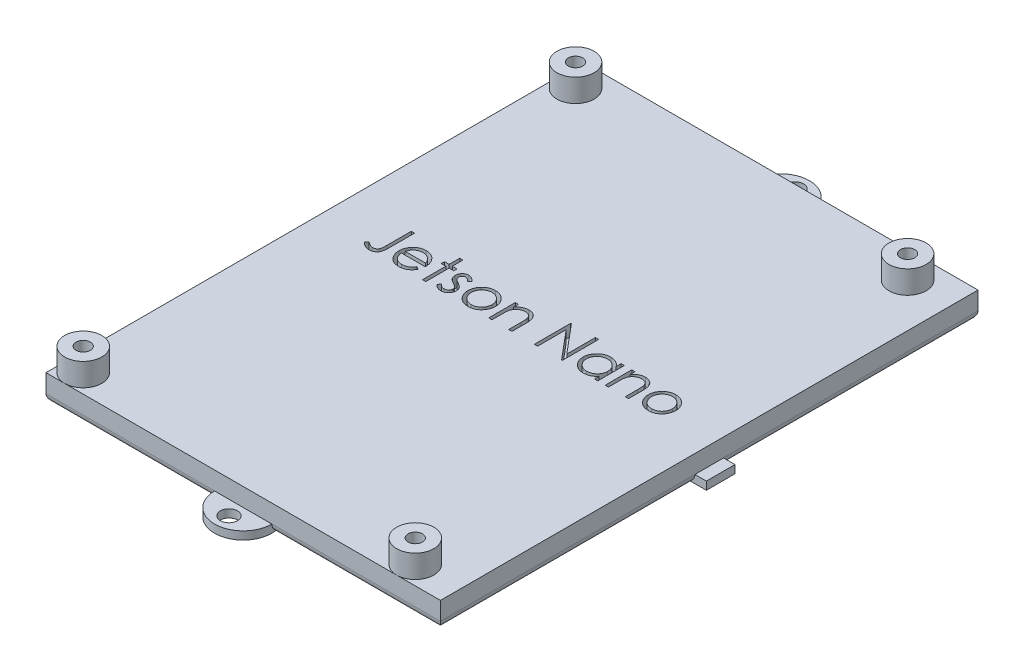
from build123d import *

# Parameters (mm, degrees)
SKETCH1_W           = 68.9
SKETCH1_H           = 93.9
BOSS_EXTRUDE1_DEPTH = 4.575
SKETCH8_R           = 3.25
SKETCH8_R_2         = 1.25
BOSS_EXTRUDE5_DEPTH = 4
CUT_EXTRUDE1_START  = -3.575
SKETCH3_R           = 1.25
CUT_EXTRUDE1_DEPTH  = 3.575
SKETCH4_R           = 1.5
BOSS_EXTRUDE3_DEPTH = 1.4
CUT_EXTRUDE2_DEPTH  = 2
SKETCH6_W           = 5
SKETCH6_H           = 1.4
BOSS_EXTRUDE4_DEPTH = 2
FILLET1_R           = 1.4


with BuildPart() as part:
    # Sketch1 → Boss-Extrude1 (new body)
    with BuildSketch(Plane(origin=(0, 0, 0), x_dir=(1, 0, 0), z_dir=(0, 1, 0))):
        Rectangle(SKETCH1_W, SKETCH1_H)
    extrude(amount=BOSS_EXTRUDE1_DEPTH)

    # Sketch8 → Boss-Extrude5 (add)
    # profile 1 of 4: a face of its own
    with BuildSketch(Plane(origin=(0, 4.575, 0), x_dir=(1, 0, 0), z_dir=(0, 1, 0))):
        with Locations(Location((-31.2, 42.3, 0), (0, 0, 180))):
            Circle(SKETCH8_R)
        with Locations(Location((-31.2, 42.3, 0), (0, 0, 270))):
            Circle(SKETCH8_R_2, mode=Mode.SUBTRACT)
    # profile 2 of 4: a face of its own
    with BuildSketch(Plane(origin=(0, 4.575, 0), x_dir=(1, 0, 0), z_dir=(0, 1, 0))):
        with Locations(Location((26.8, 42.3, 0), (0, 0, 270))):
            Circle(SKETCH8_R)
        with Locations(Location((26.8, 42.3, 0), (0, 0, 270))):
            Circle(SKETCH8_R_2, mode=Mode.SUBTRACT)
    # profile 3 of 4: a face of its own
    with BuildSketch(Plane(origin=(0, 4.575, 0), x_dir=(1, 0, 0), z_dir=(0, 1, 0))):
        with Locations(Location((26.8, -43.7, 0), (0, 0, 270))):
            Circle(SKETCH8_R)
        with Locations(Location((26.8, -43.7, 0), (0, 0, 270))):
            Circle(SKETCH8_R_2, mode=Mode.SUBTRACT)
    # profile 4 of 4: a face of its own
    with BuildSketch(Plane(origin=(0, 4.575, 0), x_dir=(1, 0, 0), z_dir=(0, 1, 0))):
        with Locations(Location((-31.2, -43.7, 0), (0, 0, 270))):
            Circle(SKETCH8_R)
        with Locations(Location((-31.2, -43.7, 0), (0, 0, 270))):
            Circle(SKETCH8_R_2, mode=Mode.SUBTRACT)
    extrude(amount=BOSS_EXTRUDE5_DEPTH)

    # Sketch3 → Cut-Extrude1 (cut)
    with BuildSketch(Plane(origin=(0, 4.575, 0), x_dir=(1, 0, 0), z_dir=(0, 1, 0)).offset(CUT_EXTRUDE1_START)):
        with Locations(Location((-31.2, 42.3, 0), (0, 0, 270))):
            Circle(SKETCH3_R)
        with Locations(Location((26.8, 42.3, 0), (0, 0, 270))):
            Circle(SKETCH3_R)
        with Locations(Location((26.8, -43.7, 0), (0, 0, 270))):
            Circle(SKETCH3_R)
        with Locations(Location((-31.2, -43.7, 0), (0, 0, 270))):
            Circle(SKETCH3_R)
    extrude(amount=CUT_EXTRUDE1_DEPTH, mode=Mode.SUBTRACT)

    # Sketch4 → Boss-Extrude3 (add)
    with BuildSketch(Plane(origin=(0, 0, 0), x_dir=(1, 0, 0), z_dir=(0, 1, 0))):
        with BuildLine():
            Line((-5, -46.95), (5, -46.95))
            ThreePointArc((5, -46.95), (0, -51.95), (-5, -46.95))
        make_face()
        with Locations(Location((0, -49.45, 0), (0, 0, 270))):
            Circle(SKETCH4_R, mode=Mode.SUBTRACT)
    boss_extrude3 = extrude(amount=BOSS_EXTRUDE3_DEPTH)

    # Mirror1: Boss-Extrude3 across plane
    add(boss_extrude3.mirror(Plane.XY))

    # Sketch5 → Cut-Extrude2 (cut)
    # profile 1 of 10: a face of its own
    with BuildSketch(Plane(origin=(0, 4.575, 0), x_dir=(1, 0, 0), z_dir=(0, 1, 0))):
        with BuildLine():
            Line((-23.934615385, 6.35), (-23.36474359, 6.35))
            Line((-23.36474359, 6.35), (-23.36474359, 2.061969151))
            add(Edge.make_bspline(
                [(-23.36474359, 2.061969151), (-23.365313128, 1.982675483), (-23.36640671, 1.830421967), (-23.372419998, 1.611122184), (-23.383547879, 1.410878225), (-23.399758545, 1.229234757), (-23.421385253, 1.066760835), (-23.446133976, 0.922201057), (-23.47609291, 0.796761919), (-23.521207785, 0.655909202), (-23.595183377, 0.501434014), (-23.706520718, 0.334601098), (-23.844828792, 0.18867191), (-24.005032095, 0.061939109), (-24.18853081, -0.039039011), (-24.39154615, -0.11152912), (-24.612828387, -0.155744817), (-24.76631553, -0.160414616), (-24.845392628, -0.162820513)],
                knots=[0, 0, 0, 0, 1.237770943, 2.376671248, 3.424123796, 4.367912054, 5.222547132, 5.982086412, 6.656319012, 7.234008312, 8.288027371, 9.317870876, 10.352700517, 11.413286737, 12.494591526, 13.606319346, 14.766767577, 16, 16, 16, 16], degree=3))
            add(Edge.make_bspline(
                [(-24.845392628, -0.162820513), (-24.907002792, -0.160859979), (-25.030966524, -0.156915255), (-25.215462524, -0.124763005), (-25.39943468, -0.075203897), (-25.583859451, -0.00262776), (-25.772380504, 0.09607954), (-25.967551104, 0.225229136), (-26.171881751, 0.384580619), (-26.306471427, 0.506206244), (-26.376923077, 0.569871795)],
                knots=[0, 0, 0, 0, 0.848567217, 1.707373443, 2.573483905, 3.470863513, 4.432650262, 5.500696352, 6.691726801, 8, 8, 8, 8], degree=3))
            Line((-26.376923077, 0.569871795), (-26.041105769, 1.058333333))
            add(Edge.make_bspline(
                [(-26.041105769, 1.058333333), (-25.963630909, 1.004907343), (-25.81734827, 0.904032107), (-25.602347356, 0.774262418), (-25.411852521, 0.663001046), (-25.287242031, 0.606300483), (-25.229547276, 0.580048077)],
                knots=[0, 0, 0, 0, 1.196737151, 2.259595785, 3.194191475, 4, 4, 4, 4], degree=3))
            add(Edge.make_bspline(
                [(-25.229547276, 0.580048077), (-25.194560025, 0.566333061), (-25.125942234, 0.539434862), (-25.021031019, 0.509415875), (-24.916718594, 0.49301036), (-24.847562207, 0.489959941), (-24.813591747, 0.488461538)],
                knots=[0, 0, 0, 0, 1.051806502, 2.062826769, 3.048436908, 4, 4, 4, 4], degree=3))
            add(Edge.make_bspline(
                [(-24.813591747, 0.488461538), (-24.769717259, 0.490317072), (-24.682993574, 0.493984777), (-24.556966042, 0.526368462), (-24.436392186, 0.575797593), (-24.325594378, 0.648171798), (-24.223476604, 0.734225947), (-24.139216049, 0.838286134), (-24.068971906, 0.953612991), (-24.026699605, 1.0627812), (-23.999766947, 1.162343086), (-23.982673424, 1.253843204), (-23.96772614, 1.360816172), (-23.954696753, 1.483389679), (-23.947068643, 1.621809123), (-23.938510162, 1.775668068), (-23.935416331, 1.945354423), (-23.934890514, 2.063665722), (-23.934615385, 2.125570913)],
                knots=[0, 0, 0, 0, 0.997221856, 1.971139923, 2.944579524, 3.951425367, 4.971190333, 5.972282193, 6.985401279, 8.033996657, 8.624075553, 9.332086008, 10.151144245, 11.082816738, 12.137127781, 13.306538797, 14.590673636, 16, 16, 16, 16], degree=3))
            Line((-23.934615385, 2.125570913), (-23.934615385, 6.35))
        make_face()
    # profile 2 of 10: a face of its own
    with BuildSketch(Plane(origin=(0, 4.575, 0), x_dir=(1, 0, 0), z_dir=(0, 1, 0))):
        with BuildLine():
            Line((-18.090885417, 1.465384615), (-17.584615385, 1.199529247))
            add(Edge.make_bspline(
                [(-17.584615385, 1.199529247), (-17.624958922, 1.127967774), (-17.703451469, 0.988737488), (-17.838435683, 0.79745397), (-17.979935586, 0.625373114), (-18.134338499, 0.477092169), (-18.297024917, 0.3478218), (-18.468897019, 0.234723175), (-18.650849588, 0.138351002), (-18.842891232, 0.05715713), (-19.046634703, -0.005271524), (-19.26257374, -0.049366324), (-19.491122024, -0.076622826), (-19.647778665, -0.07978901), (-19.727994792, -0.081410256)],
                knots=[0, 0, 0, 0, 1.120438281, 2.179929193, 3.190490725, 4.156257408, 5.095198341, 6.022838206, 6.959905092, 7.901321166, 8.864066838, 9.862729781, 10.905609505, 12, 12, 12, 12], degree=3))
            add(Edge.make_bspline(
                [(-19.727994792, -0.081410256), (-19.817152379, -0.079328953), (-19.991073004, -0.075268932), (-20.244237974, -0.040266889), (-20.482597776, 0.016832962), (-20.706139009, 0.096599015), (-20.914314239, 0.200788589), (-21.107537218, 0.327715078), (-21.286824072, 0.476726454), (-21.446525138, 0.64911343), (-21.590296182, 0.833593552), (-21.717161598, 1.0258278), (-21.82322008, 1.225332507), (-21.909494102, 1.430837601), (-21.979171499, 1.641047808), (-22.027733948, 1.857875756), (-22.055727919, 2.080734602), (-22.060017699, 2.231496911), (-22.062179487, 2.307471955)],
                knots=[0, 0, 0, 0, 1.145258523, 2.234067595, 3.276747158, 4.290159414, 5.277019952, 6.260822364, 7.254936242, 8.264827045, 9.274100331, 10.257902744, 11.220704747, 12.172965371, 13.118907548, 14.062713208, 15.023725156, 16, 16, 16, 16], degree=3))
            add(Edge.make_bspline(
                [(-22.062179487, 2.307471955), (-22.060257902, 2.378764005), (-22.056449575, 2.520055432), (-22.032445146, 2.729180063), (-21.989903243, 2.932431684), (-21.931526198, 3.129979182), (-21.856140366, 3.321491797), (-21.763916196, 3.507086084), (-21.654710025, 3.686564552), (-21.570395317, 3.799781666), (-21.527924679, 3.856810897)],
                knots=[0, 0, 0, 0, 1.024358464, 2.0301432, 3.019427413, 4.004406732, 4.986367066, 5.972626655, 6.978780325, 8, 8, 8, 8], degree=3))
            add(Edge.make_bspline(
                [(-21.527924679, 3.856810897), (-21.470397884, 3.925515847), (-21.357166595, 4.060749349), (-21.165657207, 4.238437454), (-20.958283994, 4.387288304), (-20.737645758, 4.510672679), (-20.501178155, 4.604423439), (-20.25205987, 4.674287195), (-19.987454306, 4.713435872), (-19.806560548, 4.718965513), (-19.714002404, 4.721794872)],
                knots=[0, 0, 0, 0, 1.030682036, 2.02871468, 2.997146059, 3.962720338, 4.930598197, 5.918074684, 6.934738563, 8, 8, 8, 8], degree=3))
            add(Edge.make_bspline(
                [(-19.714002404, 4.721794872), (-19.618847463, 4.71933824), (-19.432175159, 4.714518889), (-19.159974026, 4.669839684), (-18.902416726, 4.598987192), (-18.659606325, 4.498922458), (-18.431518206, 4.3698187), (-18.219634945, 4.209904216), (-18.020332915, 4.024088544), (-17.904384493, 3.881189578), (-17.845382612, 3.808473558)],
                knots=[0, 0, 0, 0, 1.056321875, 2.072262726, 3.055038591, 4.01806755, 4.982017516, 5.957941055, 6.960871419, 8, 8, 8, 8], degree=3))
            add(Edge.make_bspline(
                [(-17.845382612, 3.808473558), (-17.805238024, 3.753675631), (-17.725216062, 3.64444453), (-17.624982038, 3.466334003), (-17.537973621, 3.279987638), (-17.468426678, 3.082393242), (-17.412112154, 2.875892004), (-17.371369069, 2.659007673), (-17.347475618, 2.431804834), (-17.342778981, 2.276998083), (-17.340384615, 2.198076923)],
                knots=[0, 0, 0, 0, 0.94817472, 1.890038105, 2.849395472, 3.817997239, 4.812318967, 5.836947057, 6.897266129, 8, 8, 8, 8], degree=3))
            Line((-17.340384615, 2.198076923), (-21.492307692, 2.198076923))
            add(Edge.make_bspline(
                [(-21.492307692, 2.198076923), (-21.489514406, 2.136934652), (-21.484021522, 2.016700843), (-21.45841262, 1.840768136), (-21.418046987, 1.673176501), (-21.361315974, 1.515182982), (-21.292614697, 1.364724036), (-21.208457754, 1.222915769), (-21.108055992, 1.090404096), (-20.996067937, 0.966003718), (-20.871413636, 0.855222051), (-20.74027208, 0.756068114), (-20.600765183, 0.672963675), (-20.453992946, 0.605508732), (-20.300192707, 0.552701558), (-20.139316011, 0.516655655), (-19.971679428, 0.492512761), (-19.857405311, 0.489828226), (-19.799228766, 0.488461538)],
                knots=[0, 0, 0, 0, 1.094153842, 2.151609401, 3.174256925, 4.172055639, 5.149267565, 6.128595816, 7.11444997, 8.118368179, 9.117203808, 10.09244225, 11.054858984, 12.015122123, 12.976791628, 13.957293641, 14.960065497, 16, 16, 16, 16], degree=3))
            add(Edge.make_bspline(
                [(-19.799228766, 0.488461538), (-19.742348827, 0.489564727), (-19.629488116, 0.491753665), (-19.461411132, 0.513038703), (-19.29605799, 0.547456203), (-19.134113063, 0.594428042), (-18.978863099, 0.651717474), (-18.83508903, 0.720846944), (-18.702863496, 0.797318628), (-18.579279857, 0.884784752), (-18.459408197, 0.991842463), (-18.3404954, 1.1254387), (-18.212993472, 1.283440357), (-18.133183782, 1.402358923), (-18.090885417, 1.465384615)],
                knots=[0, 0, 0, 0, 0.99110716, 1.966546729, 2.947904876, 3.932708344, 4.903319531, 5.828989031, 6.710028674, 7.56322171, 8.463672341, 9.504779593, 10.677557249, 12, 12, 12, 12], degree=3))
        make_face()
        with BuildLine():
            add(Edge.make_bspline(
                [(-17.91025641, 2.767948718), (-17.931114572, 2.843537075), (-17.971259819, 2.989020329), (-18.055145794, 3.19048023), (-18.149618447, 3.369528279), (-18.261417874, 3.524794185), (-18.38808899, 3.662686273), (-18.534402393, 3.783188563), (-18.698478943, 3.890988796), (-18.879470526, 3.981979759), (-19.071134908, 4.05943136), (-19.271806142, 4.111365498), (-19.476562414, 4.146942811), (-19.615054619, 4.150255893), (-19.684745593, 4.151923077)],
                knots=[0, 0, 0, 0, 1.154881502, 2.222775134, 3.210006277, 4.132804581, 5.035138423, 5.962687519, 6.919655026, 7.923214229, 8.944639381, 9.960483929, 10.97369054, 12, 12, 12, 12], degree=3))
            add(Edge.make_bspline(
                [(-19.684745593, 4.151923077), (-19.741622431, 4.15081333), (-19.854055983, 4.148619594), (-20.019702207, 4.127809502), (-20.178778232, 4.093410926), (-20.332457825, 4.046303076), (-20.478727115, 3.983513183), (-20.620594766, 3.909883615), (-20.754453485, 3.820001027), (-20.838166978, 3.751495676), (-20.880458734, 3.716887019)],
                knots=[0, 0, 0, 0, 1.04873581, 2.073130211, 3.073294108, 4.04793562, 5.032784715, 6.005352987, 6.992311501, 8, 8, 8, 8], degree=3))
            add(Edge.make_bspline(
                [(-20.880458734, 3.716887019), (-20.910745117, 3.689501618), (-20.972037375, 3.63408024), (-21.053935178, 3.538595823), (-21.132349464, 3.435632274), (-21.203711948, 3.321250405), (-21.269166998, 3.196752706), (-21.330417243, 3.063189282), (-21.385546876, 2.919546603), (-21.416564104, 2.819448035), (-21.432522035, 2.767948718)],
                knots=[0, 0, 0, 0, 0.879870761, 1.780643979, 2.707998968, 3.669668524, 4.684282772, 5.740141944, 6.837334558, 8, 8, 8, 8], degree=3))
            Line((-21.432522035, 2.767948718), (-17.91025641, 2.767948718))
        make_face(mode=Mode.SUBTRACT)
    # profile 3 of 10: a face of its own
    with BuildSketch(Plane(origin=(0, 4.575, 0), x_dir=(1, 0, 0), z_dir=(0, 1, 0))):
        Polygon((-15.630769231, 6.512820513), (-15.060897436, 6.512820513), (-15.060897436, 4.640384615), (-14.246794872, 4.640384615), (-14.246794872, 4.070512821), (-15.060897436, 4.070512821), (-15.060897436, 0), (-15.630769231, 0), (-15.630769231, 4.070512821), (-16.444871795, 4.070512821), (-16.444871795, 4.640384615), (-15.630769231, 4.640384615), align=None)
    # profile 4 of 10: a face of its own
    with BuildSketch(Plane(origin=(0, 4.575, 0), x_dir=(1, 0, 0), z_dir=(0, 1, 0))):
        with BuildLine():
            Line((-11.071794872, 4.061608574), (-11.45849359, 3.663461538))
            add(Edge.make_bspline(
                [(-11.45849359, 3.663461538), (-11.491859218, 3.702129675), (-11.55618422, 3.776677291), (-11.658204193, 3.876348826), (-11.759847016, 3.960054415), (-11.859721292, 4.030724942), (-11.960338438, 4.084154108), (-12.060517704, 4.123151929), (-12.160362815, 4.147285205), (-12.227103193, 4.150395687), (-12.259875801, 4.151923077)],
                knots=[0, 0, 0, 0, 1.26578478, 2.440284043, 3.530471711, 4.527705817, 5.468200915, 6.346673037, 7.188140097, 8, 8, 8, 8], degree=3))
            add(Edge.make_bspline(
                [(-12.259875801, 4.151923077), (-12.30004298, 4.14997295), (-12.379086303, 4.146135377), (-12.492344573, 4.107829582), (-12.597483565, 4.049030871), (-12.688482657, 3.965630726), (-12.765567448, 3.869901267), (-12.821835126, 3.762865078), (-12.856244839, 3.647752198), (-12.86060771, 3.567869457), (-12.862820513, 3.527353766)],
                knots=[0, 0, 0, 0, 0.99966794, 1.967205029, 2.953328237, 3.988086729, 5.028030931, 6.008226631, 6.989793394, 8, 8, 8, 8], degree=3))
            add(Edge.make_bspline(
                [(-12.862820513, 3.527353766), (-12.860805182, 3.490683343), (-12.856780202, 3.417445871), (-12.825489798, 3.309408723), (-12.775658495, 3.204076668), (-12.729085429, 3.139555396), (-12.705088141, 3.106310096)],
                knots=[0, 0, 0, 0, 0.960159726, 1.917612774, 2.927026955, 4, 4, 4, 4], degree=3))
            add(Edge.make_bspline(
                [(-12.705088141, 3.106310096), (-12.690640088, 3.088558065), (-12.659889228, 3.050775103), (-12.602179494, 2.998335254), (-12.536824382, 2.940382885), (-12.458229637, 2.882440338), (-12.369781344, 2.821422779), (-12.2695615, 2.759733195), (-12.160750612, 2.692669167), (-12.08285007, 2.650134262), (-12.042357772, 2.62802484)],
                knots=[0, 0, 0, 0, 0.66740084, 1.420478572, 2.27185888, 3.217733974, 4.268547843, 5.408967954, 6.65319498, 8, 8, 8, 8], degree=3))
            add(Edge.make_bspline(
                [(-12.042357772, 2.62802484), (-11.992984568, 2.60036623), (-11.897611795, 2.546938904), (-11.762097775, 2.464008442), (-11.639112715, 2.381582858), (-11.527614575, 2.300543661), (-11.429748722, 2.218623459), (-11.342545891, 2.138962243), (-11.268181142, 2.059153069), (-11.226536161, 2.00339442), (-11.206630609, 1.976742788)],
                knots=[0, 0, 0, 0, 1.27191281, 2.456916733, 3.569705269, 4.599008579, 5.553216877, 6.436649441, 7.252746552, 8, 8, 8, 8], degree=3))
            add(Edge.make_bspline(
                [(-11.206630609, 1.976742788), (-11.173591509, 1.922920029), (-11.107837569, 1.815802748), (-11.038789, 1.639420743), (-10.998765358, 1.452348832), (-10.993209616, 1.324383233), (-10.990384615, 1.259314904)],
                knots=[0, 0, 0, 0, 0.995354457, 1.980940102, 2.973342416, 4, 4, 4, 4], degree=3))
            add(Edge.make_bspline(
                [(-10.990384615, 1.259314904), (-10.991690055, 1.213469453), (-10.994262567, 1.123125983), (-11.012147917, 0.990075649), (-11.042909089, 0.862831524), (-11.084807757, 0.740012936), (-11.141385119, 0.623973145), (-11.207693265, 0.511784522), (-11.287294891, 0.405873905), (-11.378174958, 0.306380363), (-11.477680354, 0.215510507), (-11.583827205, 0.135638476), (-11.696746226, 0.069282179), (-11.815630566, 0.014372195), (-11.940750338, -0.029294501), (-12.072125106, -0.059525094), (-12.209337275, -0.077618532), (-12.302645641, -0.080130367), (-12.350190304, -0.081410256)],
                knots=[0, 0, 0, 0, 1.032770009, 2.035186124, 3.017557409, 3.978232242, 4.952395191, 5.920591857, 6.910227898, 7.931268572, 8.952309245, 9.941945286, 10.918353717, 11.897095711, 12.887975737, 13.898235213, 14.929059601, 16, 16, 16, 16], degree=3))
            add(Edge.make_bspline(
                [(-12.350190304, -0.081410256), (-12.414356466, -0.079609214), (-12.541797205, -0.076032156), (-12.730282838, -0.042456873), (-12.9144705, 0.009786199), (-13.092966352, 0.081842251), (-13.261778587, 0.172829972), (-13.416230407, 0.281800315), (-13.556858346, 0.405153596), (-13.6369015, 0.499701306), (-13.676923077, 0.54697516)],
                knots=[0, 0, 0, 0, 1.013940152, 2.01379169, 3.017749504, 4.037548394, 5.051665909, 6.043208538, 7.021604269, 8, 8, 8, 8], degree=3))
            Line((-13.676923077, 0.54697516), (-13.299128606, 0.976923077))
            add(Edge.make_bspline(
                [(-13.299128606, 0.976923077), (-13.263255799, 0.938179433), (-13.19371094, 0.86306902), (-13.082493018, 0.763057716), (-12.969318962, 0.67923541), (-12.855318888, 0.609125215), (-12.738805288, 0.555104126), (-12.620431102, 0.51715182), (-12.500437104, 0.492760214), (-12.419842658, 0.489896759), (-12.379447115, 0.488461538)],
                knots=[0, 0, 0, 0, 1.179806542, 2.287233372, 3.337373186, 4.324005949, 5.273901747, 6.200048787, 7.097828587, 8, 8, 8, 8], degree=3))
            add(Edge.make_bspline(
                [(-12.379447115, 0.488461538), (-12.324441735, 0.490948606), (-12.21697045, 0.49580792), (-12.063039631, 0.539926073), (-11.92091098, 0.6091047), (-11.797497196, 0.707229795), (-11.692446132, 0.821449191), (-11.616376444, 0.950107664), (-11.568703955, 1.089429307), (-11.563105071, 1.186007913), (-11.56025641, 1.235146234)],
                knots=[0, 0, 0, 0, 1.072336372, 2.095165389, 3.102688358, 4.141489647, 5.156069229, 6.117746104, 7.042326257, 8, 8, 8, 8], degree=3))
            add(Edge.make_bspline(
                [(-11.56025641, 1.235146234), (-11.562227259, 1.275622256), (-11.566118435, 1.355536745), (-11.596676942, 1.471198078), (-11.64496026, 1.58090663), (-11.692502979, 1.645113561), (-11.716716747, 1.677814503)],
                knots=[0, 0, 0, 0, 1.013901739, 2.00181326, 2.98231254, 4, 4, 4, 4], degree=3))
            add(Edge.make_bspline(
                [(-11.716716747, 1.677814503), (-11.731271662, 1.694207232), (-11.762977525, 1.729916515), (-11.821134892, 1.781487729), (-11.890770556, 1.837073995), (-11.972667709, 1.895732735), (-12.066991447, 1.956690204), (-12.174124066, 2.019626601), (-12.292597926, 2.087531189), (-12.376364643, 2.132561135), (-12.420152244, 2.15609976)],
                knots=[0, 0, 0, 0, 0.615000592, 1.339693406, 2.178160186, 3.116406724, 4.166410947, 5.330106347, 6.604359322, 8, 8, 8, 8], degree=3))
            add(Edge.make_bspline(
                [(-12.420152244, 2.15609976), (-12.467408291, 2.182477898), (-12.559052847, 2.233633528), (-12.688860075, 2.313309845), (-12.805967417, 2.394349043), (-12.913192745, 2.472205195), (-13.007827713, 2.550983193), (-13.089499505, 2.630770492), (-13.161423625, 2.708349324), (-13.2012425, 2.763317276), (-13.22026242, 2.789573317)],
                knots=[0, 0, 0, 0, 1.262093308, 2.447601706, 3.550203992, 4.582594899, 5.537233252, 6.418365656, 7.244515135, 8, 8, 8, 8], degree=3))
            add(Edge.make_bspline(
                [(-13.22026242, 2.789573317), (-13.253156508, 2.84245179), (-13.318956179, 2.948227215), (-13.382846597, 3.124776223), (-13.42676325, 3.310640827), (-13.430686443, 3.438886977), (-13.432692308, 3.504457131)],
                knots=[0, 0, 0, 0, 0.985009483, 1.970363186, 2.962279964, 4, 4, 4, 4], degree=3))
            add(Edge.make_bspline(
                [(-13.432692308, 3.504457131), (-13.431723125, 3.547320353), (-13.429826296, 3.631209752), (-13.414687803, 3.754470183), (-13.387125698, 3.871578976), (-13.352554624, 3.984294856), (-13.304506888, 4.09043437), (-13.247092174, 4.191412924), (-13.17962356, 4.287090947), (-13.10189359, 4.375996629), (-13.016428676, 4.456749264), (-12.924091023, 4.527141061), (-12.826957329, 4.587205447), (-12.724616339, 4.637579382), (-12.616084909, 4.67568189), (-12.502121665, 4.701911717), (-12.382957284, 4.719429014), (-12.301493813, 4.720994895), (-12.259875801, 4.721794872)],
                knots=[0, 0, 0, 0, 1.087655834, 2.128696564, 3.144119009, 4.137814668, 5.115653402, 6.093965665, 7.082169637, 8.081268856, 9.086088321, 10.061021666, 11.022561449, 11.980240094, 12.950172527, 13.934149372, 14.944599409, 16, 16, 16, 16], degree=3))
            add(Edge.make_bspline(
                [(-12.259875801, 4.721794872), (-12.210541629, 4.719791282), (-12.110947827, 4.715746518), (-11.961533005, 4.683623336), (-11.812338227, 4.630767562), (-11.662980149, 4.557767538), (-11.51455291, 4.463303349), (-11.365750899, 4.34913162), (-11.214787758, 4.216003481), (-11.120524161, 4.114223458), (-11.071794872, 4.061608574)],
                knots=[0, 0, 0, 0, 0.845714091, 1.707292901, 2.609013841, 3.555613372, 4.552488639, 5.621697636, 6.770543573, 8, 8, 8, 8], degree=3))
        make_face()
    # profile 5 of 10: a face of its own
    with BuildSketch(Plane(origin=(0, 4.575, 0), x_dir=(1, 0, 0), z_dir=(0, 1, 0))):
        with BuildLine():
            add(Edge.make_bspline(
                [(-7.609314904, 4.721794872), (-7.522245023, 4.719940869), (-7.351522266, 4.716305624), (-7.101499387, 4.677452757), (-6.862838926, 4.618039682), (-6.634626835, 4.535904134), (-6.419785842, 4.425809738), (-6.215186584, 4.294438595), (-6.021390011, 4.138804461), (-5.905233944, 4.018411966), (-5.846274038, 3.957301683)],
                knots=[0, 0, 0, 0, 1.054011418, 2.066658804, 3.057071809, 4.030435133, 4.997543892, 5.974964718, 6.972108034, 8, 8, 8, 8], degree=3))
            add(Edge.make_bspline(
                [(-5.846274038, 3.957301683), (-5.795506779, 3.898856308), (-5.694954746, 3.783096639), (-5.566021228, 3.595398598), (-5.454947826, 3.401015844), (-5.365933597, 3.197367123), (-5.295747911, 2.98623022), (-5.24591729, 2.766879428), (-5.216277423, 2.53979917), (-5.212280611, 2.385577921), (-5.21025641, 2.307471955)],
                knots=[0, 0, 0, 0, 1.025258237, 2.030674902, 3.01204498, 3.988269485, 4.97094183, 5.956517959, 6.965070386, 8, 8, 8, 8], degree=3))
            add(Edge.make_bspline(
                [(-5.21025641, 2.307471955), (-5.212036837, 2.228913279), (-5.215555042, 2.073677671), (-5.248835603, 1.845042536), (-5.300599145, 1.623346215), (-5.374679765, 1.409516871), (-5.469672335, 1.202900884), (-5.585588297, 1.004400702), (-5.723241088, 0.813624688), (-5.87927691, 0.632192782), (-6.051728171, 0.464976935), (-6.238810326, 0.319238503), (-6.43684693, 0.194376595), (-6.6484713, 0.093799098), (-6.871750883, 0.014497213), (-7.107167278, -0.041201388), (-7.354354763, -0.074877586), (-7.523132722, -0.079202069), (-7.609314904, -0.081410256)],
                knots=[0, 0, 0, 0, 0.998656419, 1.973391657, 2.932242238, 3.890759089, 4.846373663, 5.82037756, 6.809684879, 7.83454468, 8.860553229, 9.859544525, 10.845671541, 11.83227036, 12.833544569, 13.85385346, 14.904124723, 16, 16, 16, 16], degree=3))
            add(Edge.make_bspline(
                [(-7.609314904, -0.081410256), (-7.695919324, -0.079194658), (-7.865538455, -0.074855295), (-8.113598451, -0.041332225), (-8.349436759, 0.014471543), (-8.573008645, 0.094059709), (-8.785542867, 0.194379809), (-8.98472694, 0.318861018), (-9.171961073, 0.465020156), (-9.344448816, 0.632181071), (-9.500474857, 0.813627706), (-9.638130172, 1.004399919), (-9.754045478, 1.202901088), (-9.84903822, 1.409516816), (-9.923118794, 1.62334623), (-9.974882348, 1.845042532), (-10.008162906, 2.073677672), (-10.011681112, 2.228913279), (-10.013461538, 2.307471955)],
                knots=[0, 0, 0, 0, 1.099876186, 2.154163076, 3.173186993, 4.173200201, 5.163417411, 6.152872554, 7.150605724, 8.17532212, 9.198891216, 10.186952605, 11.159729845, 12.11414092, 13.071450619, 14.029093627, 15.002601286, 16, 16, 16, 16], degree=3))
            add(Edge.make_bspline(
                [(-10.013461538, 2.307471955), (-10.011423533, 2.385153403), (-10.007388631, 2.538949318), (-9.977778565, 2.7656027), (-9.928142326, 2.984582249), (-9.857872507, 3.194904184), (-9.768037804, 3.397660475), (-9.658525181, 3.592523525), (-9.528276462, 3.77937282), (-9.42812435, 3.89498288), (-9.37744391, 3.953485577)],
                knots=[0, 0, 0, 0, 1.031353054, 2.041901799, 3.029428768, 4.008703097, 4.981709435, 5.96992636, 6.972712378, 8, 8, 8, 8], degree=3))
            add(Edge.make_bspline(
                [(-9.37744391, 3.953485577), (-9.318572895, 4.015125824), (-9.202792685, 4.136352216), (-9.008031422, 4.291532652), (-8.803935489, 4.425637529), (-8.586720266, 4.533544377), (-8.358695652, 4.618522831), (-8.11881217, 4.677605979), (-7.867940877, 4.716165638), (-7.696382707, 4.71989976), (-7.609314904, 4.721794872)],
                knots=[0, 0, 0, 0, 1.027980169, 2.021703884, 2.998553061, 3.971491411, 4.943284454, 5.930300938, 6.949603206, 8, 8, 8, 8], degree=3))
        make_face()
        with BuildLine():
            add(Edge.make_bspline(
                [(-7.611858974, 4.151923077), (-7.673431498, 4.150173032), (-7.79498706, 4.146718119), (-7.973911163, 4.120440178), (-8.146159728, 4.078806849), (-8.312059546, 4.019653776), (-8.471051158, 3.943274345), (-8.623286789, 3.849460606), (-8.769214215, 3.739455099), (-8.905978816, 3.613429966), (-9.031495297, 3.47576379), (-9.141219626, 3.329081768), (-9.234519461, 3.175763111), (-9.31224375, 3.015648385), (-9.370132505, 2.847115005), (-9.412174989, 2.672071574), (-9.438428139, 2.490161462), (-9.441850569, 2.3664979), (-9.443589744, 2.303655849)],
                knots=[0, 0, 0, 0, 1.021534396, 2.016698045, 2.994645724, 3.958388632, 4.93408049, 5.916473867, 6.921342795, 7.962252576, 8.998418191, 10.008913653, 10.997312074, 11.973003931, 12.956656626, 13.948281152, 14.957379055, 16, 16, 16, 16], degree=3))
            add(Edge.make_bspline(
                [(-9.443589744, 2.303655849), (-9.440674506, 2.222462886), (-9.434888306, 2.061310036), (-9.387834377, 1.823981285), (-9.309119269, 1.596139924), (-9.202825204, 1.379121624), (-9.069645351, 1.178330491), (-8.912733101, 0.999312227), (-8.733772502, 0.844760826), (-8.534896851, 0.716525577), (-8.320168303, 0.614635735), (-8.092917549, 0.542429022), (-7.855898004, 0.49549038), (-7.693917249, 0.490824991), (-7.611858974, 0.488461538)],
                knots=[0, 0, 0, 0, 1.016792936, 2.018143844, 3.017858371, 4.030088057, 5.03801393, 6.028138512, 7.003788237, 7.991172063, 8.984598303, 9.972568034, 10.972917682, 12, 12, 12, 12], degree=3))
            add(Edge.make_bspline(
                [(-7.611858974, 0.488461538), (-7.529805419, 0.490838761), (-7.367833981, 0.495531333), (-7.13114376, 0.54219262), (-6.904514125, 0.614952119), (-6.690008608, 0.716410985), (-6.491223485, 0.845247795), (-6.310975793, 0.998439508), (-6.155403313, 1.178804638), (-6.022355201, 1.379387583), (-5.914320397, 1.595803479), (-5.83597373, 1.824023336), (-5.788806682, 2.061299326), (-5.78303575, 2.222459298), (-5.780128205, 2.303655849)],
                knots=[0, 0, 0, 0, 1.02726834, 2.027799167, 3.010890988, 4.004497153, 4.992059811, 5.971914811, 6.958719428, 7.966827853, 8.981595046, 9.981490638, 10.983022906, 12, 12, 12, 12], degree=3))
            add(Edge.make_bspline(
                [(-5.780128205, 2.303655849), (-5.781866781, 2.366498275), (-5.785288032, 2.490162576), (-5.811549753, 2.672067314), (-5.853560518, 2.847130639), (-5.911566166, 3.015590702), (-5.988952734, 3.176177674), (-6.084051773, 3.328631607), (-6.193328062, 3.476271912), (-6.320359125, 3.612984946), (-6.456980967, 3.739504227), (-6.602967537, 3.849503262), (-6.754977426, 3.942862043), (-6.91350714, 4.020307079), (-7.079428227, 4.078268682), (-7.251435448, 4.120680571), (-7.429596146, 4.14660707), (-7.550716124, 4.150139741), (-7.611858974, 4.151923077)],
                knots=[0, 0, 0, 0, 1.042956736, 2.052379634, 3.044323526, 4.02829302, 5.004299113, 5.996692471, 7.007513377, 8.048758398, 9.090003419, 10.095195979, 11.07790575, 12.047570684, 13.018257071, 13.989683339, 14.985167495, 16, 16, 16, 16], degree=3))
        make_face(mode=Mode.SUBTRACT)
    # profile 6 of 10: a face of its own
    with BuildSketch(Plane(origin=(0, 4.575, 0), x_dir=(1, 0, 0), z_dir=(0, 1, 0))):
        with BuildLine():
            Line((-4.070512821, 4.640384615), (-3.500641026, 4.640384615))
            Line((-3.500641026, 4.640384615), (-3.500641026, 3.803385417))
            add(Edge.make_bspline(
                [(-3.500641026, 3.803385417), (-3.439794173, 3.879300071), (-3.321718734, 4.026615106), (-3.125078586, 4.22023672), (-2.917263224, 4.379794485), (-2.699545303, 4.506982797), (-2.471629271, 4.602861676), (-2.23490441, 4.67210558), (-1.987953443, 4.713625197), (-1.820015107, 4.719050329), (-1.73505609, 4.721794872)],
                knots=[0, 0, 0, 0, 1.12780773, 2.188550248, 3.19190651, 4.159438251, 5.104880172, 6.052711206, 7.014878035, 8, 8, 8, 8], degree=3))
            add(Edge.make_bspline(
                [(-1.73505609, 4.721794872), (-1.649184796, 4.718628589), (-1.481113962, 4.712431409), (-1.236406622, 4.663415412), (-1.007854894, 4.579694735), (-0.796273699, 4.465009979), (-0.605542898, 4.322395377), (-0.438039239, 4.156247116), (-0.29949449, 3.965137365), (-0.206607846, 3.787839638), (-0.145419885, 3.630561397), (-0.106898358, 3.495856579), (-0.074185006, 3.345782219), (-0.045824549, 3.180791822), (-0.026634646, 2.999729391), (-0.011499346, 2.80333715), (-0.000652286, 2.591678713), (-0.000221925, 2.445290118), (0, 2.369801683)],
                knots=[0, 0, 0, 0, 1.235846778, 2.418850247, 3.575807741, 4.728682307, 5.871620074, 6.994088408, 8.11269785, 9.256955736, 9.865816715, 10.540099792, 11.271859618, 12.076849838, 12.949306005, 13.892391288, 14.913166135, 16, 16, 16, 16], degree=3))
            Line((0, 2.369801683), (0, 0))
            Line((0, 0), (-0.569871795, 0))
            Line((-0.569871795, 0), (-0.569871795, 2.1828125))
            add(Edge.make_bspline(
                [(-0.569871795, 2.1828125), (-0.570222329, 2.245990364), (-0.570892842, 2.366838867), (-0.573007658, 2.539865523), (-0.57810545, 2.696776887), (-0.585268818, 2.837197825), (-0.595753631, 2.9609935), (-0.606680405, 3.068416045), (-0.620042577, 3.159329072), (-0.631949576, 3.21405715), (-0.637289663, 3.238601763)],
                knots=[0, 0, 0, 0, 1.430800155, 2.736877192, 3.918605307, 4.986035426, 5.920637409, 6.731861385, 7.431261377, 8, 8, 8, 8], degree=3))
            add(Edge.make_bspline(
                [(-0.637289663, 3.238601763), (-0.656567413, 3.310649198), (-0.693671118, 3.449318221), (-0.785354202, 3.637413118), (-0.901131358, 3.79742983), (-1.042460313, 3.928379025), (-1.207975922, 4.030288971), (-1.397218881, 4.100998861), (-1.608362986, 4.145224378), (-1.756870223, 4.149627889), (-1.83427484, 4.151923077)],
                knots=[0, 0, 0, 0, 1.084156227, 2.086665306, 3.027808233, 3.945421172, 4.874247719, 5.839848303, 6.874090471, 8, 8, 8, 8], degree=3))
            add(Edge.make_bspline(
                [(-1.83427484, 4.151923077), (-1.880117637, 4.151059468), (-1.970839349, 4.14935041), (-2.105368583, 4.132203055), (-2.235859583, 4.104156999), (-2.363621963, 4.066295329), (-2.486100388, 4.014293783), (-2.607229888, 3.955276211), (-2.722449303, 3.88171017), (-2.834215466, 3.799721471), (-2.938197275, 3.70886348), (-3.034950117, 3.612988441), (-3.121197668, 3.510888417), (-3.19933655, 3.404208512), (-3.266788543, 3.291483606), (-3.325667717, 3.173801221), (-3.375625334, 3.051006465), (-3.400449648, 2.965780283), (-3.412870593, 2.923137019)],
                knots=[0, 0, 0, 0, 1.023777757, 2.026029729, 3.023749952, 4.003683103, 4.997618607, 5.993177895, 7.010360494, 8.046726602, 9.087585522, 10.09234134, 11.086953743, 12.070360549, 13.043493632, 14.017870808, 15.008233677, 16, 16, 16, 16], degree=3))
            add(Edge.make_bspline(
                [(-3.412870593, 2.923137019), (-3.420018241, 2.891831151), (-3.435578297, 2.823679913), (-3.452384352, 2.711839324), (-3.467638096, 2.582462655), (-3.480405149, 2.435700879), (-3.488216405, 2.271040163), (-3.496733382, 2.089183715), (-3.499834107, 1.889406386), (-3.500364521, 1.750320172), (-3.500641026, 1.677814503)],
                knots=[0, 0, 0, 0, 0.615963638, 1.340920617, 2.168419149, 3.115676021, 4.16674242, 5.331190069, 6.6087489, 8, 8, 8, 8], degree=3))
            Line((-3.500641026, 1.677814503), (-3.500641026, 0))
            Line((-3.500641026, 0), (-4.070512821, 0))
            Line((-4.070512821, 0), (-4.070512821, 4.640384615))
        make_face()
    # profile 7 of 10: a face of its own
    with BuildSketch(Plane(origin=(0, 4.575, 0), x_dir=(1, 0, 0), z_dir=(0, 1, 0))):
        Polygon((3.907692308, 0), (3.907692308, 6.35), (4.027263622, 6.35), (8.222435897, 1.352173478), (8.222435897, 6.35), (8.792307692, 6.35), (8.792307692, 0), (8.662560096, 0), (4.477564103, 4.986378205), (4.477564103, 0), align=None)
    # profile 8 of 10: a face of its own
    with BuildSketch(Plane(origin=(0, 4.575, 0), x_dir=(1, 0, 0), z_dir=(0, 1, 0))):
        with BuildLine():
            Line((14.979487179, 4.640384615), (14.979487179, 0))
            Line((14.979487179, 0), (14.409615385, 0))
            Line((14.409615385, 0), (14.409615385, 0.802654247))
            add(Edge.make_bspline(
                [(14.409615385, 0.802654247), (14.345355579, 0.730010983), (14.21995176, 0.588246742), (14.010508588, 0.403040514), (13.788497751, 0.249954131), (13.554996783, 0.126310713), (13.310216542, 0.033433696), (13.05469964, -0.032581193), (12.788341849, -0.075024294), (12.606455434, -0.079262505), (12.514282853, -0.081410256)],
                knots=[0, 0, 0, 0, 1.074387032, 2.096679803, 3.090159297, 4.057316773, 5.018401886, 5.985159533, 6.978961417, 8, 8, 8, 8], degree=3))
            add(Edge.make_bspline(
                [(12.514282853, -0.081410256), (12.432335279, -0.079185267), (12.270731036, -0.074797489), (12.033006853, -0.040757309), (11.804239486, 0.013908247), (11.584212762, 0.089928433), (11.374350441, 0.190767923), (11.172855694, 0.311492759), (10.980772381, 0.455258265), (10.801028303, 0.619610831), (10.635507388, 0.79812745), (10.490253365, 0.988528657), (10.369144206, 1.189991122), (10.267870631, 1.39996413), (10.189862978, 1.620064056), (10.135482241, 1.849529775), (10.101481716, 2.088089974), (10.097095752, 2.250540251), (10.094871795, 2.33291266)],
                knots=[0, 0, 0, 0, 1.033919861, 2.038935746, 3.024066025, 3.998881131, 4.97069526, 5.957263378, 6.95902576, 7.993208707, 9.027059324, 10.027763471, 11.009749337, 11.988697705, 12.965288445, 13.950418724, 14.960734635, 16, 16, 16, 16], degree=3))
            add(Edge.make_bspline(
                [(10.094871795, 2.33291266), (10.097145043, 2.413582522), (10.101639132, 2.573062488), (10.135118545, 2.807610983), (10.191417661, 3.033522685), (10.270425899, 3.250070282), (10.37173916, 3.457515801), (10.494980118, 3.656005961), (10.640157672, 3.846087582), (10.807529897, 4.023291094), (10.988840122, 4.186977065), (11.182803106, 4.329233476), (11.384593916, 4.452091188), (11.597342521, 4.549433923), (11.817899982, 4.628190441), (12.048229805, 4.682678826), (12.28737367, 4.714786824), (12.449734991, 4.71943641), (12.532091346, 4.721794872)],
                knots=[0, 0, 0, 0, 1.020392517, 2.01726096, 2.990465484, 3.961182959, 4.928053699, 5.906110375, 6.912531644, 7.948652711, 8.985773172, 9.998621852, 10.987621588, 11.969261332, 12.953316658, 13.946091881, 14.958173133, 16, 16, 16, 16], degree=3))
            add(Edge.make_bspline(
                [(12.532091346, 4.721794872), (12.626796805, 4.71918638), (12.812509739, 4.71407125), (13.084159128, 4.671503159), (13.34114268, 4.599587654), (13.585444148, 4.501765908), (13.816186249, 4.371774642), (14.031184521, 4.20779957), (14.232689041, 4.010874845), (14.349493284, 3.859617039), (14.409615385, 3.781760817)],
                knots=[0, 0, 0, 0, 1.038897134, 2.037228247, 3.008116434, 3.962042015, 4.918381754, 5.904844433, 6.921570401, 8, 8, 8, 8], degree=3))
            Line((14.409615385, 3.781760817), (14.409615385, 4.640384615))
            Line((14.409615385, 4.640384615), (14.979487179, 4.640384615))
        make_face()
        with BuildLine():
            add(Edge.make_bspline(
                [(12.539723558, 4.151923077), (12.45642183, 4.148959191), (12.29199747, 4.143108953), (12.050617638, 4.09743704), (11.81963473, 4.021446419), (11.600203995, 3.917520684), (11.395791659, 3.786839976), (11.213104571, 3.628776895), (11.050648527, 3.447644026), (10.914017819, 3.244258769), (10.802637917, 3.026221375), (10.724320588, 2.798302752), (10.672669239, 2.564613721), (10.667392352, 2.406112848), (10.66474359, 2.326552484)],
                knots=[0, 0, 0, 0, 1.031046209, 2.035121221, 3.029706178, 4.034933723, 5.034054252, 6.02443088, 7.017295772, 8.038157696, 9.050218397, 10.03989886, 11.016116709, 12, 12, 12, 12], degree=3))
            add(Edge.make_bspline(
                [(10.66474359, 2.326552484), (10.668127039, 2.247467575), (10.674880676, 2.089607744), (10.723414078, 1.855600126), (10.804838992, 1.627627793), (10.915949591, 1.407625704), (11.055081039, 1.203365979), (11.216350451, 1.018780328), (11.40131739, 0.860049218), (11.606200153, 0.727175335), (11.825017471, 0.619837618), (12.055130461, 0.545151387), (12.292213404, 0.496931699), (12.453416924, 0.491299291), (12.534635417, 0.488461538)],
                knots=[0, 0, 0, 0, 0.979072187, 1.954306742, 2.945804271, 3.96968567, 4.997920485, 5.998718438, 6.996577872, 8.005894225, 9.015743152, 10.005417472, 10.995077863, 12, 12, 12, 12], degree=3))
            add(Edge.make_bspline(
                [(12.534635417, 0.488461538), (12.617088357, 0.491473187), (12.781079079, 0.497463058), (13.02317502, 0.543330497), (13.258115881, 0.619111031), (13.482701281, 0.724156589), (13.691917691, 0.854344935), (13.879692411, 1.0067578), (14.038471383, 1.184019291), (14.173077974, 1.378830856), (14.278624802, 1.59239405), (14.355507081, 1.819786081), (14.400962024, 2.061014867), (14.406691048, 2.225867992), (14.409615385, 2.310016026)],
                knots=[0, 0, 0, 0, 1.01762866, 2.023962475, 3.030623092, 4.058876274, 5.077231937, 6.066672613, 7.034107872, 8.005628644, 8.981990164, 9.965428785, 10.961468474, 12, 12, 12, 12], degree=3))
            add(Edge.make_bspline(
                [(14.409615385, 2.310016026), (14.407874294, 2.374128947), (14.404447276, 2.500323464), (14.3782661, 2.685611961), (14.336619305, 2.862928863), (14.277934111, 3.032460599), (14.20084278, 3.193269842), (14.107864691, 3.346511235), (13.997364803, 3.491387776), (13.871121912, 3.62590449), (13.732936473, 3.748598215), (13.586714949, 3.858116194), (13.430724937, 3.948084396), (13.267589741, 4.022544989), (13.09702632, 4.081798018), (12.917646767, 4.121327119), (12.731357748, 4.148469416), (12.60427419, 4.150759736), (12.539723558, 4.151923077)],
                knots=[0, 0, 0, 0, 1.050140795, 2.067009409, 3.05949893, 4.030605086, 5.00011959, 5.97591094, 6.962425594, 7.979863591, 8.993523472, 9.986985069, 10.967611495, 11.937549037, 12.921786183, 13.919465291, 14.943216303, 16, 16, 16, 16], degree=3))
        make_face(mode=Mode.SUBTRACT)
    # profile 9 of 10: a face of its own
    with BuildSketch(Plane(origin=(0, 4.575, 0), x_dir=(1, 0, 0), z_dir=(0, 1, 0))):
        with BuildLine():
            Line((16.282051282, 4.640384615), (16.851923077, 4.640384615))
            Line((16.851923077, 4.640384615), (16.851923077, 3.803385417))
            add(Edge.make_bspline(
                [(16.851923077, 3.803385417), (16.912769929, 3.879300071), (17.030845369, 4.026615106), (17.227485517, 4.22023672), (17.435300879, 4.379794485), (17.653018799, 4.506982797), (17.880934832, 4.602861676), (18.117659693, 4.67210558), (18.36461066, 4.713625197), (18.532548995, 4.719050329), (18.617508013, 4.721794872)],
                knots=[0, 0, 0, 0, 1.12780773, 2.188550248, 3.19190651, 4.159438251, 5.104880172, 6.052711206, 7.014878035, 8, 8, 8, 8], degree=3))
            add(Edge.make_bspline(
                [(18.617508013, 4.721794872), (18.703379306, 4.718628589), (18.871450141, 4.712431409), (19.11615748, 4.663415412), (19.344709209, 4.579694735), (19.556290403, 4.465009979), (19.747021204, 4.322395377), (19.914524864, 4.156247116), (20.053069612, 3.965137365), (20.145956257, 3.787839638), (20.207144217, 3.630561397), (20.245665744, 3.495856579), (20.278379096, 3.345782219), (20.306739553, 3.180791822), (20.325929456, 2.999729391), (20.341064757, 2.80333715), (20.351911816, 2.591678713), (20.352342178, 2.445290118), (20.352564103, 2.369801683)],
                knots=[0, 0, 0, 0, 1.235846778, 2.418850247, 3.575807741, 4.728682307, 5.871620074, 6.994088408, 8.11269785, 9.256955736, 9.865816715, 10.540099792, 11.271859618, 12.076849838, 12.949306005, 13.892391288, 14.913166135, 16, 16, 16, 16], degree=3))
            Line((20.352564103, 2.369801683), (20.352564103, 0))
            Line((20.352564103, 0), (19.782692308, 0))
            Line((19.782692308, 0), (19.782692308, 2.1828125))
            add(Edge.make_bspline(
                [(19.782692308, 2.1828125), (19.782341773, 2.245990364), (19.78167126, 2.366838867), (19.779556444, 2.539865523), (19.774458652, 2.696776887), (19.767295284, 2.837197825), (19.756810472, 2.9609935), (19.745883698, 3.068416045), (19.732521526, 3.159329072), (19.720614526, 3.21405715), (19.715274439, 3.238601763)],
                knots=[0, 0, 0, 0, 1.430800155, 2.736877192, 3.918605307, 4.986035426, 5.920637409, 6.731861385, 7.431261377, 8, 8, 8, 8], degree=3))
            add(Edge.make_bspline(
                [(19.715274439, 3.238601763), (19.695996689, 3.310649198), (19.658892985, 3.449318221), (19.567209901, 3.637413118), (19.451432744, 3.79742983), (19.310103789, 3.928379025), (19.144588181, 4.030288971), (18.955345222, 4.100998861), (18.744201116, 4.145224378), (18.595693879, 4.149627889), (18.518289263, 4.151923077)],
                knots=[0, 0, 0, 0, 1.084156227, 2.086665306, 3.027808233, 3.945421172, 4.874247719, 5.839848303, 6.874090471, 8, 8, 8, 8], degree=3))
            add(Edge.make_bspline(
                [(18.518289263, 4.151923077), (18.472446465, 4.151059468), (18.381724754, 4.14935041), (18.247195519, 4.132203055), (18.116704519, 4.104156999), (17.98894214, 4.066295329), (17.866463714, 4.014293783), (17.745334215, 3.955276211), (17.6301148, 3.88171017), (17.518348636, 3.799721471), (17.414366828, 3.70886348), (17.317613986, 3.612988441), (17.231366434, 3.510888417), (17.153227552, 3.404208512), (17.08577556, 3.291483606), (17.026896386, 3.173801221), (16.976938768, 3.051006465), (16.952114455, 2.965780283), (16.93969351, 2.923137019)],
                knots=[0, 0, 0, 0, 1.023777757, 2.026029729, 3.023749952, 4.003683103, 4.997618607, 5.993177895, 7.010360494, 8.046726602, 9.087585522, 10.09234134, 11.086953743, 12.070360549, 13.043493632, 14.017870808, 15.008233677, 16, 16, 16, 16], degree=3))
            add(Edge.make_bspline(
                [(16.93969351, 2.923137019), (16.932545861, 2.891831151), (16.916985805, 2.823679913), (16.900179751, 2.711839324), (16.884926007, 2.582462655), (16.872158953, 2.435700879), (16.864347697, 2.271040163), (16.85583072, 2.089183715), (16.852729995, 1.889406386), (16.852199582, 1.750320172), (16.851923077, 1.677814503)],
                knots=[0, 0, 0, 0, 0.615963638, 1.340920617, 2.168419149, 3.115676021, 4.16674242, 5.331190069, 6.6087489, 8, 8, 8, 8], degree=3))
            Line((16.851923077, 1.677814503), (16.851923077, 0))
            Line((16.851923077, 0), (16.282051282, 0))
            Line((16.282051282, 0), (16.282051282, 4.640384615))
        make_face()
    # profile 10 of 10: a face of its own
    with BuildSketch(Plane(origin=(0, 4.575, 0), x_dir=(1, 0, 0), z_dir=(0, 1, 0))):
        with BuildLine():
            add(Edge.make_bspline(
                [(23.896454327, 4.721794872), (23.983524208, 4.719940869), (24.154246965, 4.716305624), (24.404269844, 4.677452757), (24.642930305, 4.618039682), (24.871142396, 4.535904134), (25.085983389, 4.425809738), (25.290582646, 4.294438595), (25.48437922, 4.138804461), (25.600535287, 4.018411966), (25.659495192, 3.957301683)],
                knots=[0, 0, 0, 0, 1.054011418, 2.066658804, 3.057071809, 4.030435133, 4.997543892, 5.974964718, 6.972108034, 8, 8, 8, 8], degree=3))
            add(Edge.make_bspline(
                [(25.659495192, 3.957301683), (25.710262452, 3.898856308), (25.810814485, 3.783096639), (25.939748003, 3.595398598), (26.050821405, 3.401015844), (26.139835634, 3.197367123), (26.21002132, 2.98623022), (26.25985194, 2.766879428), (26.289491808, 2.53979917), (26.293488619, 2.385577921), (26.295512821, 2.307471955)],
                knots=[0, 0, 0, 0, 1.025258237, 2.030674902, 3.01204498, 3.988269485, 4.97094183, 5.956517959, 6.965070386, 8, 8, 8, 8], degree=3))
            add(Edge.make_bspline(
                [(26.295512821, 2.307471955), (26.293732394, 2.228913279), (26.290214189, 2.073677671), (26.256933628, 1.845042536), (26.205170086, 1.623346215), (26.131089465, 1.409516871), (26.036096896, 1.202900884), (25.920180934, 1.004400702), (25.782528143, 0.813624688), (25.62649232, 0.632192782), (25.454041059, 0.464976935), (25.266958905, 0.319238503), (25.0689223, 0.194376595), (24.857297931, 0.093799098), (24.634018348, 0.014497213), (24.398601953, -0.041201388), (24.151414468, -0.074877586), (23.982636509, -0.079202069), (23.896454327, -0.081410256)],
                knots=[0, 0, 0, 0, 0.998656419, 1.973391657, 2.932242238, 3.890759089, 4.846373663, 5.82037756, 6.809684879, 7.83454468, 8.860553229, 9.859544525, 10.845671541, 11.83227036, 12.833544569, 13.85385346, 14.904124723, 16, 16, 16, 16], degree=3))
            add(Edge.make_bspline(
                [(23.896454327, -0.081410256), (23.809849907, -0.079194658), (23.640230776, -0.074855295), (23.39217078, -0.041332225), (23.156332472, 0.014471543), (22.932760586, 0.094059709), (22.720226363, 0.194379809), (22.52104229, 0.318861018), (22.333808158, 0.465020156), (22.161320415, 0.632181071), (22.005294374, 0.813627706), (21.867639059, 1.004399919), (21.751723753, 1.202901088), (21.656731011, 1.409516816), (21.582650436, 1.62334623), (21.530886882, 1.845042532), (21.497606325, 2.073677672), (21.494088119, 2.228913279), (21.492307692, 2.307471955)],
                knots=[0, 0, 0, 0, 1.099876186, 2.154163076, 3.173186993, 4.173200201, 5.163417411, 6.152872554, 7.150605724, 8.17532212, 9.198891216, 10.186952605, 11.159729845, 12.11414092, 13.071450619, 14.029093627, 15.002601286, 16, 16, 16, 16], degree=3))
            add(Edge.make_bspline(
                [(21.492307692, 2.307471955), (21.494345698, 2.385153403), (21.4983806, 2.538949318), (21.527990666, 2.7656027), (21.577626904, 2.984582249), (21.647896724, 3.194904184), (21.737731427, 3.397660475), (21.84724405, 3.592523525), (21.977492769, 3.77937282), (22.077644881, 3.89498288), (22.128325321, 3.953485577)],
                knots=[0, 0, 0, 0, 1.031353054, 2.041901799, 3.029428768, 4.008703097, 4.981709435, 5.96992636, 6.972712378, 8, 8, 8, 8], degree=3))
            add(Edge.make_bspline(
                [(22.128325321, 3.953485577), (22.187196336, 4.015125824), (22.302976546, 4.136352216), (22.497737809, 4.291532652), (22.701833742, 4.425637529), (22.919048965, 4.533544377), (23.147073578, 4.618522831), (23.386957061, 4.677605979), (23.637828354, 4.716165638), (23.809386523, 4.71989976), (23.896454327, 4.721794872)],
                knots=[0, 0, 0, 0, 1.027980169, 2.021703884, 2.998553061, 3.971491411, 4.943284454, 5.930300938, 6.949603206, 8, 8, 8, 8], degree=3))
        make_face()
        with BuildLine():
            add(Edge.make_bspline(
                [(23.893910256, 4.151923077), (23.832337733, 4.150173032), (23.710782171, 4.146718119), (23.531858067, 4.120440178), (23.359609502, 4.078806849), (23.193709685, 4.019653776), (23.034718072, 3.943274345), (22.882482442, 3.849460606), (22.736555016, 3.739455099), (22.599790415, 3.613429966), (22.474273934, 3.47576379), (22.364549605, 3.329081768), (22.271249769, 3.175763111), (22.193525481, 3.015648385), (22.135636726, 2.847115005), (22.093594242, 2.672071574), (22.067341091, 2.490161462), (22.063918662, 2.3664979), (22.062179487, 2.303655849)],
                knots=[0, 0, 0, 0, 1.021534396, 2.016698045, 2.994645724, 3.958388632, 4.93408049, 5.916473867, 6.921342795, 7.962252576, 8.998418191, 10.008913653, 10.997312074, 11.973003931, 12.956656626, 13.948281152, 14.957379055, 16, 16, 16, 16], degree=3))
            add(Edge.make_bspline(
                [(22.062179487, 2.303655849), (22.065094724, 2.222462886), (22.070880925, 2.061310036), (22.117934854, 1.823981285), (22.196649962, 1.596139924), (22.302944026, 1.379121624), (22.43612388, 1.178330491), (22.59303613, 0.999312227), (22.771996729, 0.844760826), (22.970872379, 0.716525577), (23.185600928, 0.614635735), (23.412851682, 0.542429022), (23.649871227, 0.49549038), (23.811851982, 0.490824991), (23.893910256, 0.488461538)],
                knots=[0, 0, 0, 0, 1.016792936, 2.018143844, 3.017858371, 4.030088057, 5.03801393, 6.028138512, 7.003788237, 7.991172063, 8.984598303, 9.972568034, 10.972917682, 12, 12, 12, 12], degree=3))
            add(Edge.make_bspline(
                [(23.893910256, 0.488461538), (23.975963811, 0.490838761), (24.13793525, 0.495531333), (24.374625471, 0.54219262), (24.601255105, 0.614952119), (24.815760623, 0.716410985), (25.014545746, 0.845247795), (25.194793438, 0.998439508), (25.350365918, 1.178804638), (25.48341403, 1.379387583), (25.591448834, 1.595803479), (25.6697955, 1.824023336), (25.716962549, 2.061299326), (25.722733481, 2.222459298), (25.725641026, 2.303655849)],
                knots=[0, 0, 0, 0, 1.02726834, 2.027799167, 3.010890988, 4.004497153, 4.992059811, 5.971914811, 6.958719428, 7.966827853, 8.981595046, 9.981490638, 10.983022906, 12, 12, 12, 12], degree=3))
            add(Edge.make_bspline(
                [(25.725641026, 2.303655849), (25.72390245, 2.366498275), (25.720481199, 2.490162576), (25.694219478, 2.672067314), (25.652208713, 2.847130639), (25.594203064, 3.015590702), (25.516816496, 3.176177674), (25.421717457, 3.328631607), (25.312441168, 3.476271912), (25.185410106, 3.612984946), (25.048788264, 3.739504227), (24.902801694, 3.849503262), (24.750791805, 3.942862043), (24.59226209, 4.020307079), (24.426341003, 4.078268682), (24.254333783, 4.120680571), (24.076173085, 4.14660707), (23.955053107, 4.150139741), (23.893910256, 4.151923077)],
                knots=[0, 0, 0, 0, 1.042956736, 2.052379634, 3.044323526, 4.02829302, 5.004299113, 5.996692471, 7.007513377, 8.048758398, 9.090003419, 10.095195979, 11.07790575, 12.047570684, 13.018257071, 13.989683339, 14.985167495, 16, 16, 16, 16], degree=3))
        make_face(mode=Mode.SUBTRACT)
    extrude(amount=-CUT_EXTRUDE2_DEPTH, mode=Mode.SUBTRACT)

    # Sketch6 → Boss-Extrude4 (add)
    with BuildSketch(Plane.ZY.offset(34.45)):
        with Locations((0, 0.7)):
            Rectangle(SKETCH6_W, SKETCH6_H)
    boss_extrude4 = extrude(amount=BOSS_EXTRUDE4_DEPTH)

    # Mirror2: Boss-Extrude4 across plane
    add(boss_extrude4.mirror(Plane(origin=(0, 0, 0), x_dir=(0, 0, 1), z_dir=(1, 0, 0))))

    # Fillet1
    fillet1_edges = [part.edges().sort_by_distance(p)[0] for p in [
        (-19.725, 0, 46.95),
        (19.725, 0, 46.95),
        (34.45, 0, -24.725),
        (34.45, 0, 24.725),
        (19.725, 0, -46.95),
        (-19.725, 0, -46.95),
        (-34.45, 0, 24.725),
        (-34.45, 0, -24.725),
    ]]
    fillet(fillet1_edges, radius=FILLET1_R)


solid = part.part
